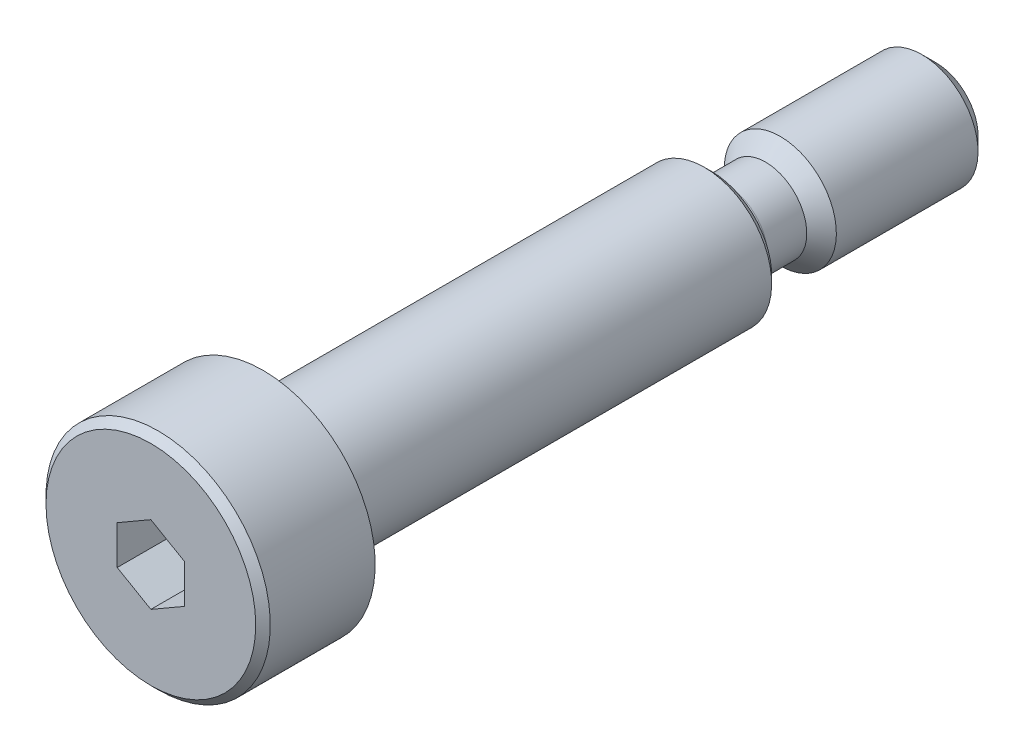
from build123d import *

# Parameters (mm, degrees)
SKETCH4_W          = 0.666666667
SKETCH4_H          = 0.666666667
CHAMFER1_SIZE      = 0.195
CHAMFER2_SIZE      = 0.625
CHAMFER3_SIZE      = 0.325
CUT_EXTRUDE1_DEPTH = 2.5


with BuildPart() as part:
    # Sketch3 → Revolve1 (revolve)
    with BuildSketch(Plane(origin=(0, 0, 0), x_dir=(0, 0, -1), z_dir=(1, 0, 0))):
        Polygon((-17.5, 5), (-12.5, 5), (-12.5, 3), (7.5, 3), (7.5, 2.5), (17.5, 2.5), (17.5, 0), (-17.5, 0), align=None)
    revolve(axis=Axis((0, 0, -17.5), (0, 0, 1)))

    # Sketch4 → Cut-Revolve1 (revolve, cut)
    with BuildSketch(Plane(origin=(0, 0, 0), x_dir=(0, 0, -1), z_dir=(1, 0, 0))):
        with Locations((-12.166666666, 2.666666667)):
            Rectangle(SKETCH4_W, SKETCH4_H)
    revolve(axis=Axis((0, 0, -17.5), (0, 0, 1)), mode=Mode.SUBTRACT)

    # Chamfer1
    chamfer1_edges = [part.edges().sort_by_distance(p)[0] for p in [
        (0, -3, 11.833333333),
        (0, -2.333333333, 11.833333333),
    ]]
    chamfer(chamfer1_edges, length=CHAMFER1_SIZE)

    # Sketch6 → Cut-Revolve2 (revolve, cut)
    with BuildSketch(Plane(origin=(0, 0, 0), x_dir=(0, 0, -1), z_dir=(1, 0, 0))):
        with BuildLine():
            Line((7.5, 3), (11.06, 3))
            Line((11.06, 3), (9.9, 1.84))
            Line((9.9, 1.84), (8.16, 1.84))
            ThreePointArc((8.16, 1.84), (7.693309524, 2.033309524), (7.5, 2.5))
            Line((7.5, 2.5), (7.5, 3))
        make_face()
    revolve(axis=Axis((0, 0, -17.5), (0, 0, 1)), mode=Mode.SUBTRACT)

    # Chamfer2
    chamfer2_edges = [part.edges().sort_by_distance(p)[0] for p in [
        (0, -2.5, -17.5),
    ]]
    chamfer(chamfer2_edges, length=CHAMFER2_SIZE)

    # Chamfer3
    chamfer3_edges = [part.edges().sort_by_distance(p)[0] for p in [
        (0, -5, 17.5),
        (0, -3, -7.5),
    ]]
    chamfer(chamfer3_edges, length=CHAMFER3_SIZE)

    # Sketch8 → Cut-Extrude1 (cut)
    with BuildSketch(Plane.XY.offset(17.5)):
        Polygon((1.5, 0.866025404), (0, 1.732050808), (-1.5, 0.866025404), (-1.5, -0.866025404), (0, -1.732050808), (1.5, -0.866025404), align=None)
    extrude(amount=-CUT_EXTRUDE1_DEPTH, mode=Mode.SUBTRACT)


solid = part.part
